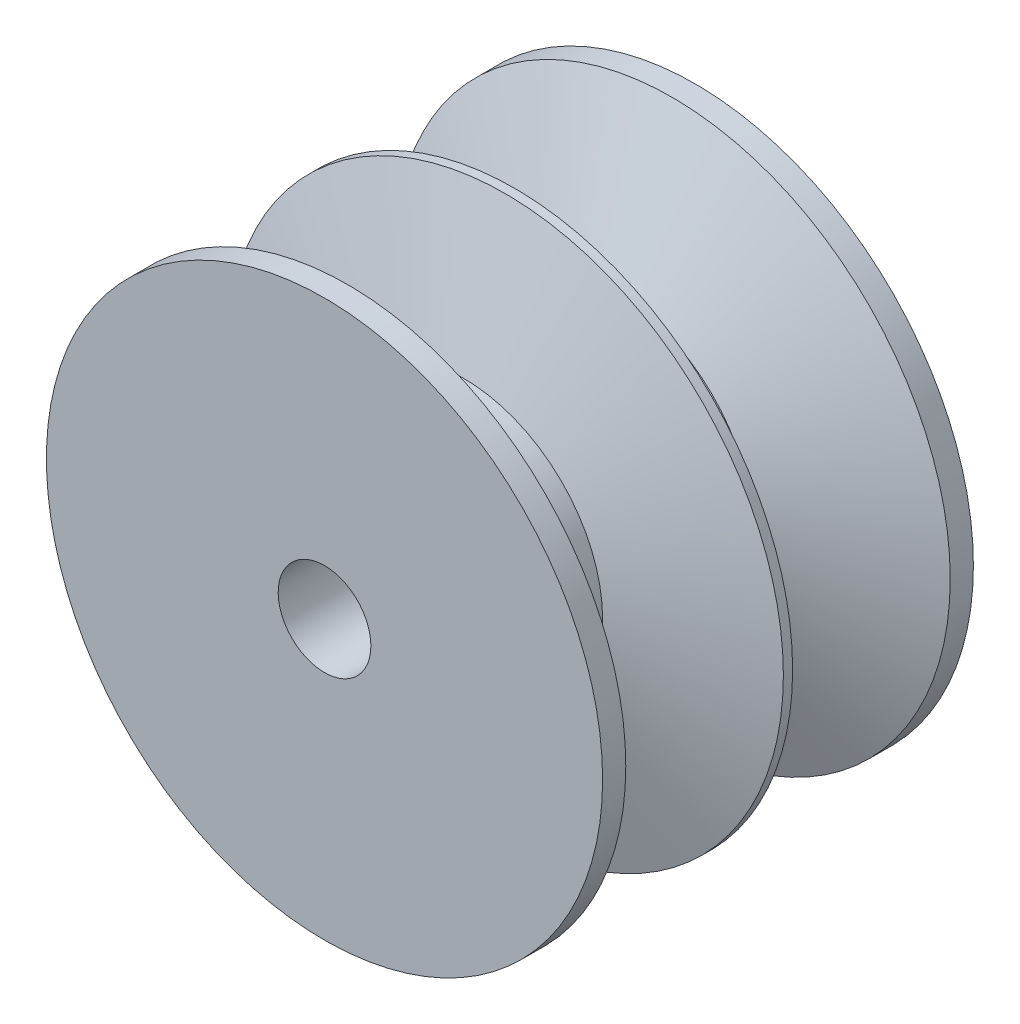
from build123d import *

# Parameters (mm, degrees)
CUT_EXTRUDE1_DEPTH = 12
CUT_EXTRUDE2_START = -4
SKETCH4_R          = 2
CUT_EXTRUDE2_DEPTH = 4


with BuildPart() as part:
    # Sketch1 → Revolve1 (revolve)
    with BuildSketch(Plane(origin=(0, 0, 0), x_dir=(0, 0, -1), z_dir=(1, 0, 0)), mode=Mode.PRIVATE) as revolve1_sk:
        Polygon((-8, 0), (8, 0), (8, 12), (7, 12), (4.5, 6), (2, 6), (0.2, 12), (-0.2, 12), (-2, 6), (-4.5, 6), (-7, 12), (-8, 12), align=None)
    revolve(revolve1_sk.sketch.rotate(Axis((0, 0, 8), (0, 0, -1)), 90), axis=Axis((0, 0, 8), (0, 0, -1)))

    # Sketch3 → Cut-Extrude1 (cut)
    with BuildSketch(Plane(origin=(0, 0, -8), x_dir=(-1, 0, 0), z_dir=(0, 0, -1))):
        with BuildLine():
            Line((-1.322875656, 1.5), (1.322875656, 1.5))
            ThreePointArc((1.322875656, 1.5), (0, -2), (-1.322875656, 1.5))
        make_face()
    extrude(amount=-CUT_EXTRUDE1_DEPTH, mode=Mode.SUBTRACT)

    # Sketch4 → Cut-Extrude2 (cut)
    with BuildSketch(Plane.XY.offset(8).offset(CUT_EXTRUDE2_START)):
        with Locations(Location((0, 0, 0), (0, 0, 131.409622109))):
            Circle(SKETCH4_R)
    extrude(amount=CUT_EXTRUDE2_DEPTH, mode=Mode.SUBTRACT)


solid = part.part
